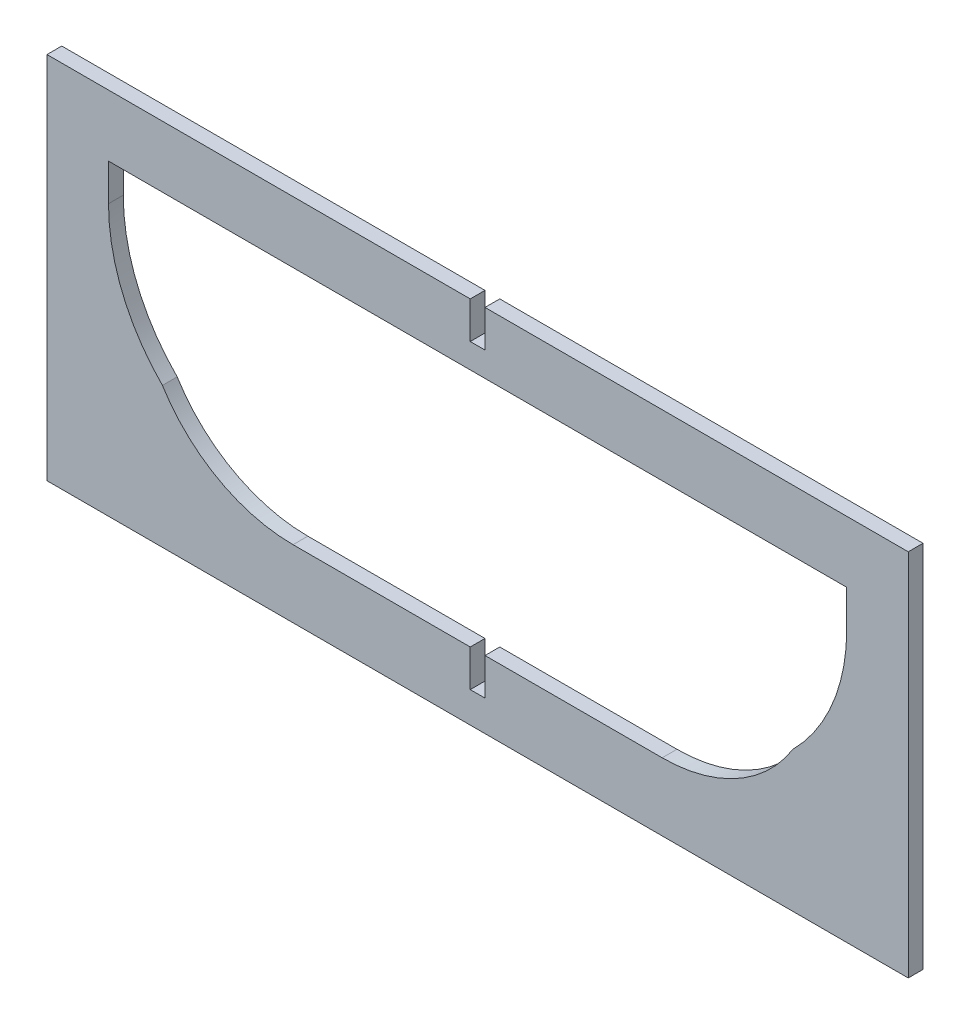
from build123d import *

# Parameters (mm, degrees)
SKETCH1_W           = 200
SKETCH1_H           = 150
BOSS_EXTRUDE1_DEPTH = 6
SKETCH3_W           = 100
SKETCH3_H           = 97.5
CUT_EXTRUDE1_DEPTH  = 6
BOSS_EXTRUDE3_DEPTH = 6
SKETCH5_W           = 6
SKETCH5_H           = 15
CUT_EXTRUDE2_DEPTH  = 6


with BuildPart() as part:
    # Sketch1 → Boss-Extrude1 (new body)
    with BuildSketch(Plane.XY):
        with Locations((-100, 75)):
            Rectangle(SKETCH1_W, SKETCH1_H)
        with BuildLine():
            Line((-175, 110), (-175, 125))
            Line((-175, 125), (-25, 125))
            Line((-25, 125), (-25, 110))
            ThreePointArc((-25, 110), (-30.691670032, 81.340701386), (-46.902810588, 57.03125))
            ThreePointArc((-46.902810588, 57.03125), (-100, 27.5), (-153.097189412, 57.03125))
            ThreePointArc((-153.097189412, 57.03125), (-169.308329968, 81.340701386), (-175, 110))
        make_face(mode=Mode.SUBTRACT)
    extrude(amount=BOSS_EXTRUDE1_DEPTH)

    # Sketch3 → Cut-Extrude1 (cut)
    with BuildSketch(Plane.XY.offset(6)):
        with Locations((-150, 76.25)):
            Rectangle(SKETCH3_W, SKETCH3_H)
    extrude(amount=-CUT_EXTRUDE1_DEPTH, mode=Mode.SUBTRACT)

    # Sketch4 → Boss-Extrude3 (add)
    with BuildSketch(Plane.XY.offset(6)):
        with BuildLine():
            Line((-200, 27.5), (-250, 27.5))
            ThreePointArc((-250, 27.5), (-280.378472024, 35.379505335), (-303.097189412, 57.03125))
            ThreePointArc((-303.097189412, 57.03125), (-319.308329968, 81.340701386), (-325, 110))
            Line((-325, 110), (-325, 125))
            Line((-325, 125), (-200, 125))
            Line((-200, 125), (-200, 150))
            Line((-200, 150), (-350, 150))
            Line((-350, 150), (-350, 0))
            Line((-350, 0), (-200, 0))
            Line((-200, 0), (-200, 27.5))
        make_face()
    extrude(amount=-BOSS_EXTRUDE3_DEPTH)

    # Sketch5 → Cut-Extrude2 (cut)
    with BuildSketch(Plane.XY.offset(6)):
        with Locations((-175, 142.5)):
            Rectangle(SKETCH5_W, SKETCH5_H)
        with Locations((-175, 20)):
            Rectangle(SKETCH5_W, SKETCH5_H)
    extrude(amount=-CUT_EXTRUDE2_DEPTH, mode=Mode.SUBTRACT)


solid = part.part
